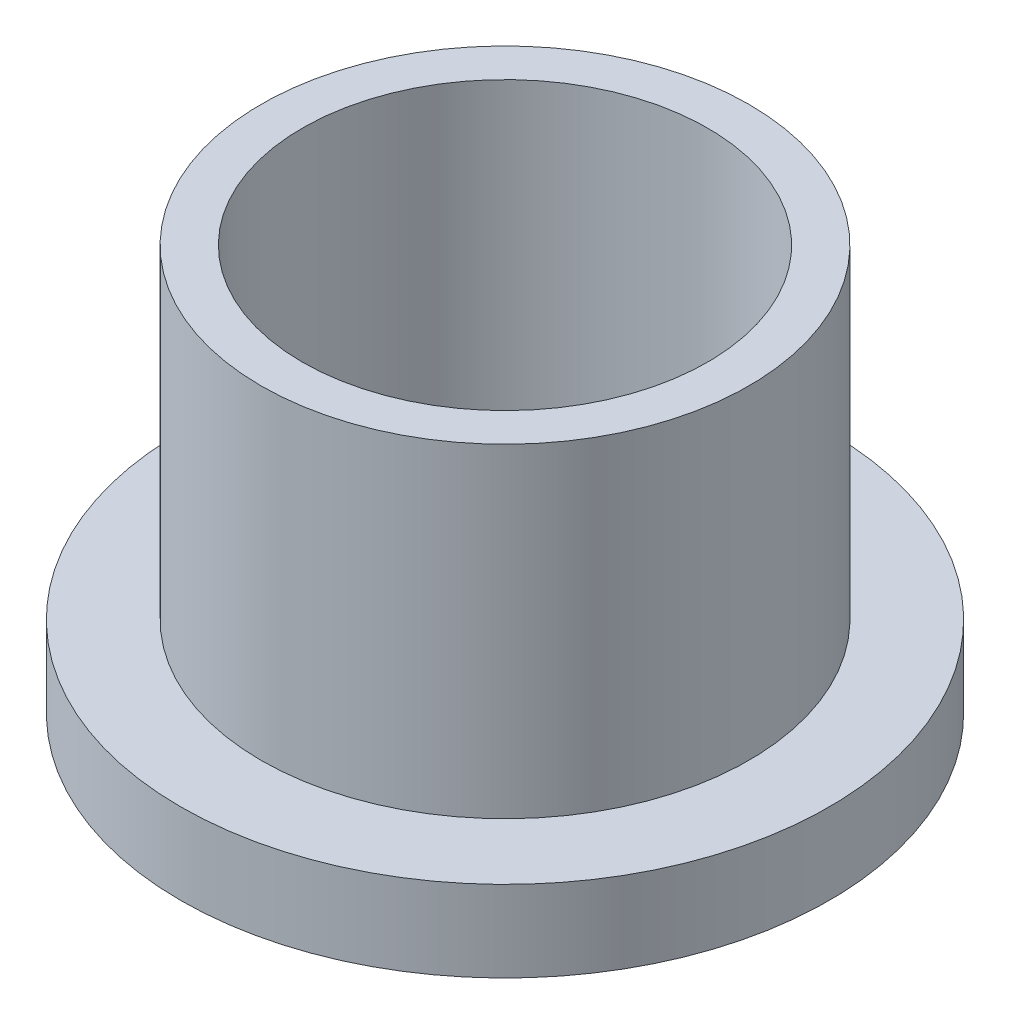
from build123d import *

# Parameters (mm, degrees)
SKETCH2_R           = 9.5504
SKETCH2_R_2         = 7.9375
BOSS_EXTRUDE1_DEPTH = 15.875
SKETCH3_R           = 12.7
SKETCH3_R_2         = 9.5504
BOSS_EXTRUDE2_DEPTH = 3.175


with BuildPart() as part:
    # Sketch2 → Boss-Extrude1 (new body)
    with BuildSketch(Plane(origin=(0, 0, 0), x_dir=(1, 0, 0), z_dir=(0, 1, 0))):
        with Locations(Location((0, 0, 0), (0, 0, 270))):
            Circle(SKETCH2_R)
        with Locations(Location((0, 0, 0), (0, 0, 270))):
            Circle(SKETCH2_R_2, mode=Mode.SUBTRACT)
    extrude(amount=BOSS_EXTRUDE1_DEPTH)

    # Sketch3 → Boss-Extrude2 (add)
    with BuildSketch(Plane(origin=(0, 0, 0), x_dir=(1, 0, 0), z_dir=(0, 1, 0))):
        with Locations(Location((0, 0, 0), (0, 0, 270))):
            Circle(SKETCH3_R)
        with Locations(Location((0, 0, 0), (0, 0, 270))):
            Circle(SKETCH3_R_2, mode=Mode.SUBTRACT)
    extrude(amount=BOSS_EXTRUDE2_DEPTH)


solid = part.part
